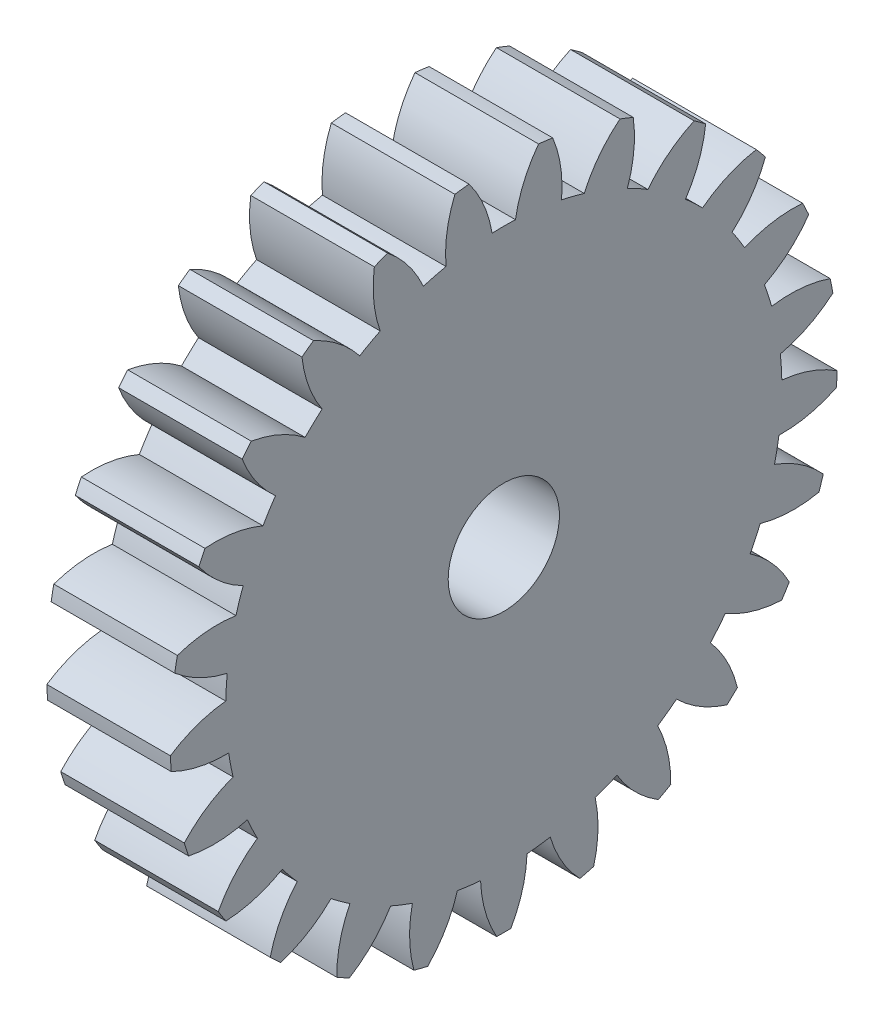
from build123d import *

# Parameters (mm, degrees)
BASPROSKE_W     = 10
BASPROSKE_H     = 27
TOOTHCUT_DEPTH  = 40.471508712
TEETHCUTS_COUNT = 25
TEETHCUTS_ANGLE = 345.6
BORSKE_R        = 4.5
BORE_DEPTH      = 50.0000508


with BuildPart() as part:
    # BasProSke → Base-Revolve (revolve)
    with BuildSketch(Plane(origin=(0, 0, 0), x_dir=(1, 0, 0), z_dir=(0, 1, 0)), mode=Mode.PRIVATE) as base_revolve_sk:
        with Locations((5, 13.5)):
            Rectangle(BASPROSKE_W, BASPROSKE_H)
    revolve(base_revolve_sk.sketch.rotate(Axis((-10, 0, 0), (1, 0, 0)), 180), axis=Axis((-10, 0, 0), (1, 0, 0)))

    # TooCutSke → ToothCut (cut, through all)
    with BuildSketch(Plane(origin=(0, 0, 0), x_dir=(0, 0, -1), z_dir=(1, 0, 0))):
        with BuildLine():
            ThreePointArc((0.946154762, 22.479096783), (0, 22.499), (-0.946154762, 22.479096783))
            ThreePointArc((-0.946154762, 22.479096783), (-1.62094792, 24.792268013), (-2.829470045, 26.876873784))
            ThreePointArc((-2.829470045, 26.876873784), (0, 27.0254), (2.829470045, 26.876873784))
            ThreePointArc((2.829470045, 26.876873784), (1.62094792, 24.792268013), (0.946154762, 22.479096783))
        make_face()
    toothcut = extrude(amount=TOOTHCUT_DEPTH, mode=Mode.SUBTRACT)

    # TeethCuts: ToothCut ×25 about axis
    teethcuts_axis = Axis((-10, 0, 0), (1, 0, 0))
    for i in range(1, TEETHCUTS_COUNT):
        add(toothcut.rotate(teethcuts_axis, i * TEETHCUTS_ANGLE / (TEETHCUTS_COUNT - 1)), mode=Mode.SUBTRACT)

    # BorSke → Bore (cut, symmetric)
    with BuildSketch(Plane(origin=(0, 0, 0), x_dir=(0, 0, -1), z_dir=(1, 0, 0))):
        with Locations(Location((0, 0, 0), (0, 0, 180))):
            Circle(BORSKE_R)
    extrude(amount=BORE_DEPTH, both=True, mode=Mode.SUBTRACT)


solid = part.part
